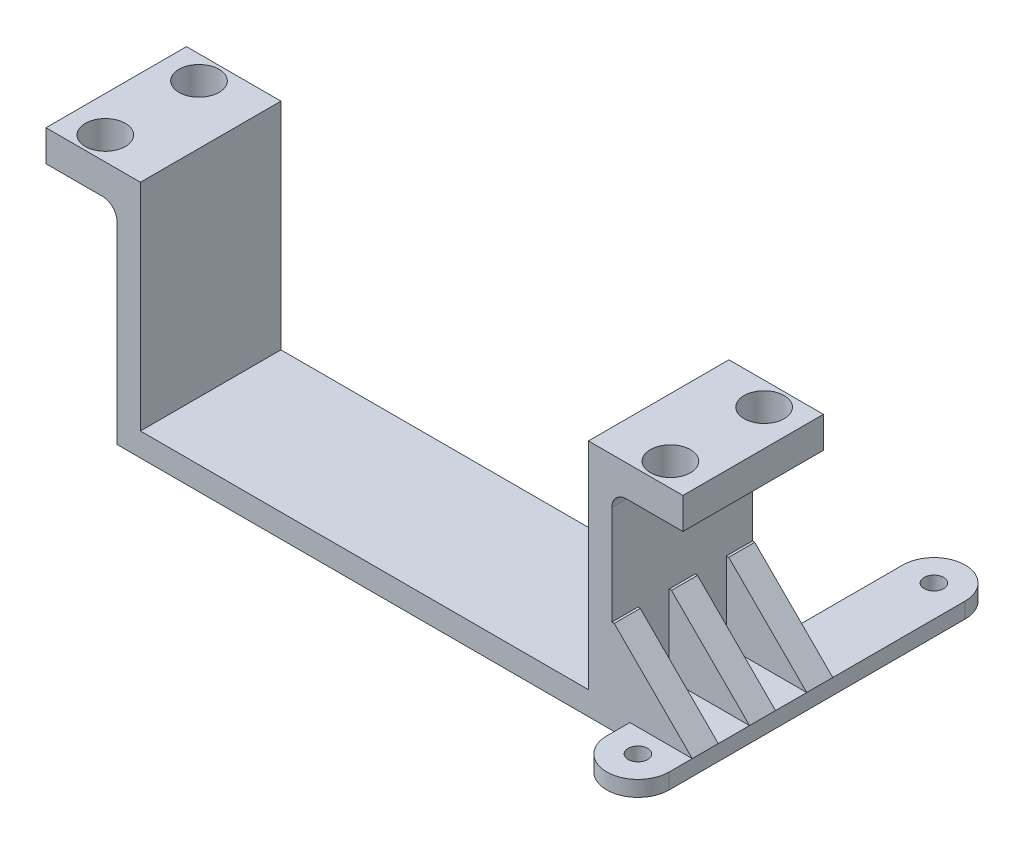
from build123d import *

# Parameters (mm, degrees)
BOSS_EXTRUDE1_DEPTH = 22.86
SKETCH2_R           = 1.5875
BOSS_EXTRUDE2_DEPTH = 2.54
SKETCH4_W           = 15.367
SKETCH4_H           = 22.86
SKETCH4_R           = 3.2639
BOSS_EXTRUDE3_DEPTH = 5.08
SKETCH5_W           = 13.081
SKETCH5_H           = 4.233333333
SKETCH5_H_2         = 4.233333334
BOSS_EXTRUDE4_DEPTH = 12.7
CHAMFER1_SIZE       = 12.7
FILLET1_R           = 2.38


with BuildPart() as part:
    # Sketch1 → Boss-Extrude1 (new body)
    with BuildSketch(Plane.XY):
        Polygon((-3.81, 35.052), (0, 35.052), (0, 0), (72.898, 0), (72.898, 35.052), (76.708, 35.052), (76.708, -3.81), (-3.81, -3.81), align=None)
    extrude(amount=BOSS_EXTRUDE1_DEPTH)

    # Sketch2 → Boss-Extrude2 (add)
    with BuildSketch(Plane.XZ.offset(3.81)):
        with BuildLine():
            ThreePointArc((89.789, 26.6192), (84.709, 31.6992), (79.629, 26.6192))
            Line((79.629, 26.6192), (79.629, 22.86))
            Line((79.629, 22.86), (76.708, 22.86))
            Line((76.708, 22.86), (76.708, 0))
            Line((76.708, 0), (79.629, 0))
            Line((79.629, 0), (79.629, -21.5392))
            ThreePointArc((79.629, -21.5392), (84.709, -26.6192), (89.789, -21.5392))
            Line((89.789, -21.5392), (89.789, 26.6192))
        make_face()
        with Locations((84.709, -21.5392)):
            Circle(SKETCH2_R, mode=Mode.SUBTRACT)
        with Locations((84.709, 26.6192)):
            Circle(SKETCH2_R, mode=Mode.SUBTRACT)
    extrude(amount=-BOSS_EXTRUDE2_DEPTH)

    # Sketch4 → Boss-Extrude3 (add)
    with BuildSketch(Plane(origin=(0, 35.052, 0), x_dir=(1, 0, 0), z_dir=(0, 1, 0))):
        with Locations((-7.6835, -11.43)):
            Rectangle(SKETCH4_W, SKETCH4_H)
        with Locations(Location((-9.525, -3.81, 0), (0, 0, 270))):
            Circle(SKETCH4_R, mode=Mode.SUBTRACT)
        with Locations(Location((-9.525, -19.05, 0), (0, 0, 270))):
            Circle(SKETCH4_R, mode=Mode.SUBTRACT)
    boss_extrude3 = extrude(amount=-BOSS_EXTRUDE3_DEPTH)

    # Mirror1: Boss-Extrude3 across plane
    add(boss_extrude3.mirror(Plane(origin=(36.449, 0, 0), x_dir=(0, 0, 1), z_dir=(1, 0, 0))))

    # Sketch5 → Boss-Extrude4 (add)
    with BuildSketch(Plane(origin=(0, -1.27, 0), x_dir=(1, 0, 0), z_dir=(0, 1, 0))):
        with Locations((83.2485, -2.116666667)):
            Rectangle(SKETCH5_W, SKETCH5_H)
        with Locations((83.2485, -20.743333334)):
            Rectangle(SKETCH5_W, SKETCH5_H)
        with Locations((83.2485, -11.43)):
            Rectangle(SKETCH5_W, SKETCH5_H_2)
    extrude(amount=BOSS_EXTRUDE4_DEPTH)

    # Chamfer1
    chamfer1_edges = [part.edges().sort_by_distance(p)[0] for p in [
        (89.789, 11.43, 20.743333333),
        (89.789, 11.43, 11.43),
        (89.789, 11.43, 2.116666667),
    ]]
    chamfer(chamfer1_edges, length=CHAMFER1_SIZE)

    # Fillet1
    fillet1_edges = [part.edges().sort_by_distance(p)[0] for p in [
        (-3.81, 29.972, 11.43),
        (76.708, 29.972, 11.43),
    ]]
    fillet(fillet1_edges, radius=FILLET1_R)


solid = part.part
